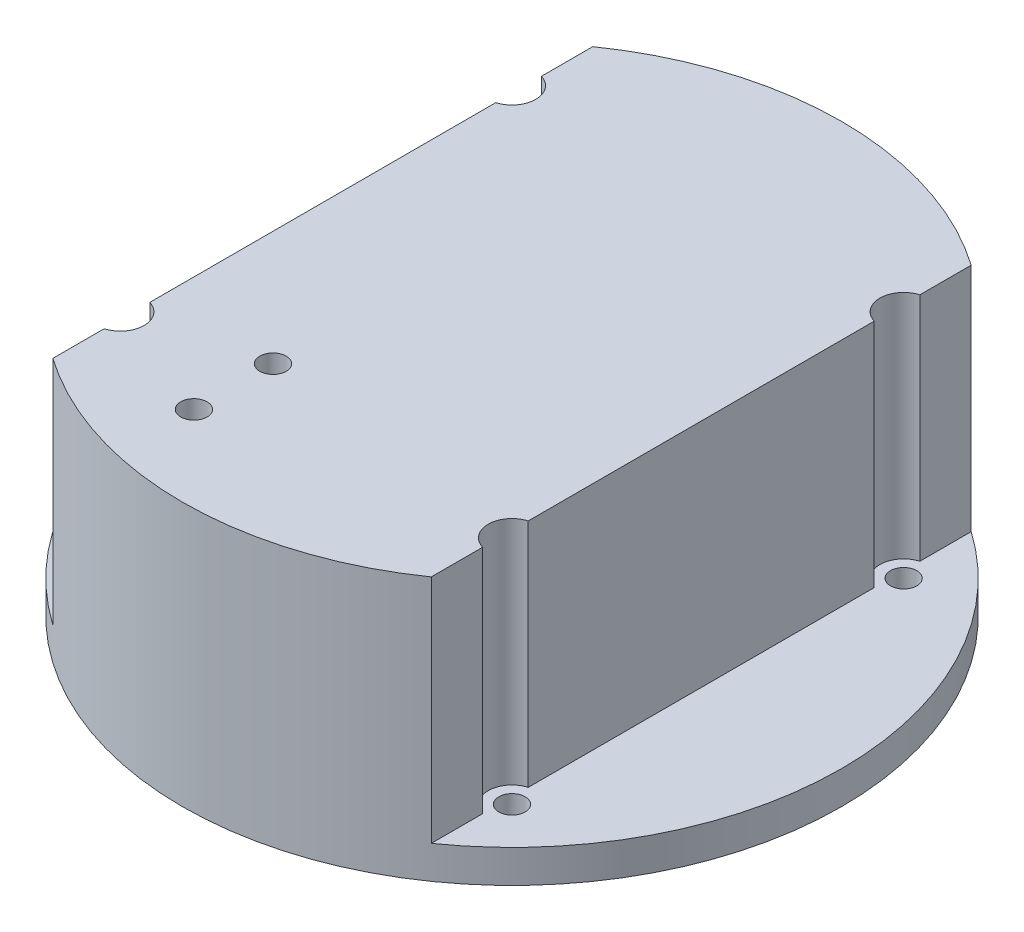
from build123d import *

# Parameters (mm, degrees)
ARA_D_ZLEM_R                = 50
BASE_DEPTH                  = 5
Y_KSEKLIK_EKSTR_ZYON2_DEPTH = 40
IZIM2_R                     = 2
BANANA_SLOTLAR_DEPTH        = 82.240384046
IZIM3_R                     = 2
IZIM3_R_2                   = 5.05
KES_EKSTR_ZYON1_DEPTH       = 5
IZIM3_2_R                   = 2
KES_EKSTR_ZYON2_DEPTH       = 82.240384046
IZIM5_R                     = 3.6
KES_EKSTR_ZYON3_DEPTH       = 79.89866919


with BuildPart() as part:
    # ara düzlem → base (new body)
    with BuildSketch(Plane(origin=(0, 0, 0), x_dir=(1, 0, 0), z_dir=(0, 1, 0))):
        Circle(ARA_D_ZLEM_R)
    extrude(amount=BASE_DEPTH)

    # Çizim1<3> → Yükseklik-Ekstrüzyon2 (add)
    with BuildSketch(Plane(origin=(0, 0, 0), x_dir=(1, 0, 0), z_dir=(0, 1, 0))):
        with BuildLine():
            ThreePointArc((28.7, 40.942764929), (0, 50), (-28.7, 40.942764929))
            Line((-28.7, 40.942764929), (-28.7, -40.942764929))
            ThreePointArc((-28.7, -40.942764929), (0, -50), (28.7, -40.942764929))
            Line((28.7, -40.942764929), (28.7, 40.942764929))
        make_face()
    extrude(amount=Y_KSEKLIK_EKSTR_ZYON2_DEPTH)

    # Çizim2 → banana slotlar (cut, through all)
    with BuildSketch(Plane(origin=(0, 40, 0), x_dir=(1, 0, 0), z_dir=(0, 1, 0))):
        with Locations((-11.3, -24.942764929)):
            Circle(IZIM2_R)
        with Locations((-11.3, -36.942764929)):
            Circle(IZIM2_R)
    extrude(amount=-BANANA_SLOTLAR_DEPTH, mode=Mode.SUBTRACT)

    # Çizim3 → Kes-Ekstrüzyon1 (cut)
    with BuildSketch(Plane.XZ):
        with Locations((-29.69848481, 29.69848481)):
            Circle(IZIM3_R)
        with Locations((29.69848481, 29.69848481)):
            Circle(IZIM3_R)
        with Locations((29.69848481, -29.69848481)):
            Circle(IZIM3_R)
        with Locations((-29.69848481, -29.69848481)):
            Circle(IZIM3_R)
        Circle(IZIM3_R_2)
    extrude(amount=-KES_EKSTR_ZYON1_DEPTH, mode=Mode.SUBTRACT)

    # Çizim3<2> → Kes-Ekstrüzyon2 (cut, through all)
    with BuildSketch(Plane.XZ):
        with Locations((-29.69848481, 29.69848481)):
            Circle(IZIM3_2_R)
        with Locations((29.69848481, 29.69848481)):
            Circle(IZIM3_2_R)
        with Locations((29.69848481, -29.69848481)):
            Circle(IZIM3_2_R)
        with Locations((-29.69848481, -29.69848481)):
            Circle(IZIM3_2_R)
    extrude(amount=-KES_EKSTR_ZYON2_DEPTH, mode=Mode.SUBTRACT)

    # Çizim5 → Kes-Ekstrüzyon3 (cut, through all)
    with BuildSketch(Plane(origin=(0, 5, 0), x_dir=(1, 0, 0), z_dir=(0, 1, 0))):
        with Locations((29.69848481, -29.69848481)):
            Circle(IZIM5_R)
        with Locations((-29.69848481, -29.69848481)):
            Circle(IZIM5_R)
        with Locations((-29.69848481, 29.69848481)):
            Circle(IZIM5_R)
        with Locations((29.69848481, 29.69848481)):
            Circle(IZIM5_R)
    extrude(amount=KES_EKSTR_ZYON3_DEPTH, mode=Mode.SUBTRACT)


solid = part.part
